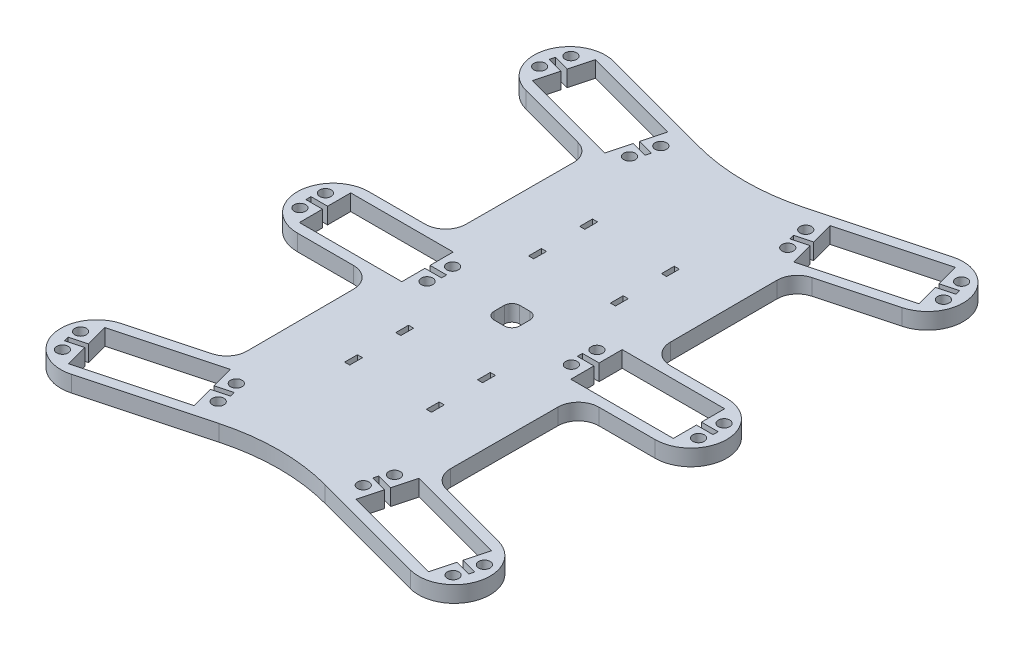
from build123d import *

# Parameters (mm, degrees)
SKETCH1_R           = 2.25
SKETCH1_W           = 40.1
SKETCH1_H           = 20.1
BOSS_EXTRUDE1_DEPTH = 6.35
FILLET1_R           = 80
FILLET2_R           = 8
SKETCH5_W           = 6.5
SKETCH5_H           = 2
CUT_EXTRUDE2_DEPTH  = 136.852736293
SKETCH6_W           = 2
SKETCH6_H           = 5
SKETCH6_W_2         = 10
SKETCH6_H_2         = 10
CUT_EXTRUDE3_DEPTH  = 10
FILLET3_R           = 3


with BuildPart() as part:
    # Sketch1 → Boss-Extrude1 (new body)
    with BuildSketch(Plane(origin=(0, 0, 0), x_dir=(1, 0, 0), z_dir=(0, 1, 0))):
        with BuildLine():
            Line((-70, 14), (-40, 14))
            Line((-40, 14), (-39.816062711, 70))
            Line((-39.816062711, 70), (-73.623466631, 79.058666579))
            ThreePointArc((-73.623466631, 79.058666579), (-83.522961568, 96.205094778), (-66.376533369, 106.104589715))
            Line((-66.376533369, 106.104589715), (0, 88.319051202))
            Line((0, 88.319051202), (66.376533369, 106.104589715))
            ThreePointArc((66.376533369, 106.104589715), (83.522961568, 96.205094778), (73.623466631, 79.058666579))
            Line((73.623466631, 79.058666579), (39.816062711, 70))
            Line((39.816062711, 70), (40, 14))
            Line((40, 14), (70, 14))
            ThreePointArc((70, 14), (84, 0), (70, -14))
            Line((70, -14), (40, -14))
            Line((40, -14), (39.816062711, -70))
            Line((39.816062711, -70), (73.623466631, -79.058666579))
            ThreePointArc((73.623466631, -79.058666579), (83.522961568, -96.205094778), (66.376533369, -106.104589715))
            Line((66.376533369, -106.104589715), (0, -88.319051202))
            Line((0, -88.319051202), (-66.376533369, -106.104589715))
            ThreePointArc((-66.376533369, -106.104589715), (-83.522961568, -96.205094778), (-73.623466631, -79.058666579))
            Line((-73.623466631, -79.058666579), (-39.816062711, -70))
            Line((-39.816062711, -70), (-40, -14))
            Line((-40, -14), (-70, -14))
            ThreePointArc((-70, -14), (-84, 0), (-70, 14))
        make_face()
        with Locations(Location((-76.433311385, 99.481809639, 0), (0, 0, 270))):
            Circle(SKETCH1_R, mode=Mode.SUBTRACT)
        with Locations(Location((-79.021501836, 89.822551376, 0), (0, 0, 270))):
            Circle(SKETCH1_R, mode=Mode.SUBTRACT)
        with Locations(Location((-78, 5, 0), (0, 0, 270))):
            Circle(SKETCH1_R, mode=Mode.SUBTRACT)
        with Locations(Location((-79.021501836, -89.822551376, 0), (0, 0, 90))):
            Circle(SKETCH1_R, mode=Mode.SUBTRACT)
        with Locations(Location((-76.433311385, -99.481809639, 0), (0, 0, 90))):
            Circle(SKETCH1_R, mode=Mode.SUBTRACT)
        with Locations(Location((-78, -5, 0), (0, 0, 270))):
            Circle(SKETCH1_R, mode=Mode.SUBTRACT)
        with Locations(Location((78, -5, 0), (0, 0, 90))):
            Circle(SKETCH1_R, mode=Mode.SUBTRACT)
        with Locations(Location((76.433311385, -99.481809639, 0), (0, 0, 270))):
            Circle(SKETCH1_R, mode=Mode.SUBTRACT)
        with Locations(Location((79.021501836, -89.822551376, 0), (0, 0, 270))):
            Circle(SKETCH1_R, mode=Mode.SUBTRACT)
        with Locations(Location((78, 5, 0), (0, 0, 90))):
            Circle(SKETCH1_R, mode=Mode.SUBTRACT)
        with Locations(Location((79.021501836, 89.822551376, 0), (0, 0, 90))):
            Circle(SKETCH1_R, mode=Mode.SUBTRACT)
        with Locations(Location((76.433311385, 99.481809639, 0), (0, 0, 90))):
            Circle(SKETCH1_R, mode=Mode.SUBTRACT)
        with Locations(Location((-30.95703272, 76.943715692, 0), (0, 0, 90))):
            Circle(SKETCH1_R, mode=Mode.SUBTRACT)
        with Locations(Location((-28.368842269, 86.602973955, 0), (0, 0, 90))):
            Circle(SKETCH1_R, mode=Mode.SUBTRACT)
        with Locations(Location((-28.24, -5, 0), (0, 0, 90))):
            Circle(SKETCH1_R, mode=Mode.SUBTRACT)
        with Locations(Location((-28.24, 5, 0), (0, 0, 90))):
            Circle(SKETCH1_R, mode=Mode.SUBTRACT)
        with Locations(Location((-28.368842269, -86.602973955, 0), (0, 0, 270))):
            Circle(SKETCH1_R, mode=Mode.SUBTRACT)
        with Locations(Location((-30.95703272, -76.943715692, 0), (0, 0, 270))):
            Circle(SKETCH1_R, mode=Mode.SUBTRACT)
        with Locations(Location((28.368842269, 86.602973955, 0), (0, 0, 270))):
            Circle(SKETCH1_R, mode=Mode.SUBTRACT)
        with Locations(Location((30.95703272, 76.943715692, 0), (0, 0, 270))):
            Circle(SKETCH1_R, mode=Mode.SUBTRACT)
        with Locations(Location((28.24, 5, 0), (0, 0, 270))):
            Circle(SKETCH1_R, mode=Mode.SUBTRACT)
        with Locations(Location((28.24, -5, 0), (0, 0, 270))):
            Circle(SKETCH1_R, mode=Mode.SUBTRACT)
        with Locations(Location((30.95703272, -76.943715692, 0), (0, 0, 90))):
            Circle(SKETCH1_R, mode=Mode.SUBTRACT)
        with Locations(Location((28.368842269, -86.602973955, 0), (0, 0, 90))):
            Circle(SKETCH1_R, mode=Mode.SUBTRACT)
        Polygon((-70.460853466, 103.109639074), (-75.663116273, 83.694529965), (-36.929490638, 73.315886257), (-31.727227832, 92.730995365), align=None, mode=Mode.SUBTRACT)
        with Locations((-53.12, 0)):
            Rectangle(SKETCH1_W, SKETCH1_H, mode=Mode.SUBTRACT)
        Polygon((-36.929490638, -73.315886257), (-31.727227832, -92.730995365), (-70.460853466, -103.109639074), (-75.663116273, -83.694529965), align=None, mode=Mode.SUBTRACT)
        Polygon((36.929490638, 73.315886257), (31.727227832, 92.730995365), (70.460853466, 103.109639074), (75.663116273, 83.694529965), align=None, mode=Mode.SUBTRACT)
        with Locations((53.12, 0)):
            Rectangle(SKETCH1_W, SKETCH1_H, mode=Mode.SUBTRACT)
        Polygon((36.929490638, -73.315886257), (31.727227832, -92.730995365), (70.460853466, -103.109639074), (75.663116273, -83.694529965), align=None, mode=Mode.SUBTRACT)
    extrude(amount=BOSS_EXTRUDE1_DEPTH)

    # Fillet1
    fillet1_edges = [part.edges().sort_by_distance(p)[0] for p in [
        (0, 3.175, -88.319051202),
        (0, 3.175, 88.319051202),
    ]]
    fillet(fillet1_edges, radius=FILLET1_R)

    # Fillet2
    fillet2_edges = [part.edges().sort_by_distance(p)[0] for p in [
        (-40, 3.175, -14),
        (-39.816062711, 3.175, -70),
        (39.816062711, 3.175, -70),
        (40, 3.175, -14),
        (40, 3.175, 14),
        (39.816062711, 3.175, 70),
        (-39.816062711, 3.175, 70),
        (-40, 3.175, 14),
    ]]
    fillet(fillet2_edges, radius=FILLET2_R)

    # Sketch5 → Cut-Extrude2 (cut, through all)
    with BuildSketch(Plane(origin=(0, 6.35, 0), x_dir=(1, 0, 0), z_dir=(0, 1, 0))):
        with Locations((-29.82, 0)):
            Rectangle(SKETCH5_W, SKETCH5_H)
        with Locations((-76.42, 0)):
            Rectangle(SKETCH5_W, SKETCH5_H)
        Polygon((-34.06954019, 83.989366637), (-27.791022319, 82.307042844), (-28.308660409, 80.375191192), (-34.58717828, 82.057514985), align=None)
        Polygon((-72.803165824, 94.368010346), (-73.320803914, 92.436158693), (-79.599321785, 94.118482486), (-79.081683695, 96.050334139), align=None)
        Polygon((72.803165824, 94.368010346), (79.081683695, 96.050334139), (79.599321785, 94.118482486), (73.320803914, 92.436158693), align=None)
        Polygon((34.06954019, 83.989366637), (34.58717828, 82.057514985), (28.308660409, 80.375191192), (27.791022319, 82.307042844), align=None)
        with Locations((76.42, 0)):
            Rectangle(SKETCH5_W, SKETCH5_H)
        with Locations((29.82, 0)):
            Rectangle(SKETCH5_W, SKETCH5_H)
        Polygon((34.06954019, -83.989366637), (27.791022319, -82.307042844), (28.308660409, -80.375191192), (34.58717828, -82.057514985), align=None)
        Polygon((72.803165824, -94.368010346), (73.320803914, -92.436158693), (79.599321785, -94.118482486), (79.081683695, -96.050334139), align=None)
        Polygon((-72.803165824, -94.368010346), (-79.081683695, -96.050334139), (-79.599321785, -94.118482486), (-73.320803914, -92.436158693), align=None)
        Polygon((-34.06954019, -83.989366637), (-34.58717828, -82.057514985), (-28.308660409, -80.375191192), (-27.791022319, -82.307042844), align=None)
    extrude(amount=-CUT_EXTRUDE2_DEPTH, mode=Mode.SUBTRACT)

    # Sketch6 → Cut-Extrude3 (cut)
    with BuildSketch(Plane(origin=(0, 6.35, 0), x_dir=(1, 0, 0), z_dir=(0, 1, 0))):
        with Locations((-16, -26)):
            Rectangle(SKETCH6_W, SKETCH6_H)
        with Locations((-16, -46)):
            Rectangle(SKETCH6_W, SKETCH6_H)
        with Locations((16, -46)):
            Rectangle(SKETCH6_W, SKETCH6_H)
        with Locations((16, -26)):
            Rectangle(SKETCH6_W, SKETCH6_H)
        with Locations((16, 26)):
            Rectangle(SKETCH6_W, SKETCH6_H)
        with Locations((16, 46)):
            Rectangle(SKETCH6_W, SKETCH6_H)
        with Locations((-16, 46)):
            Rectangle(SKETCH6_W, SKETCH6_H)
        with Locations((-16, 26)):
            Rectangle(SKETCH6_W, SKETCH6_H)
        Rectangle(SKETCH6_W_2, SKETCH6_H_2)
    extrude(amount=-CUT_EXTRUDE3_DEPTH, mode=Mode.SUBTRACT)

    # Fillet3
    fillet3_edges = [part.edges().sort_by_distance(p)[0] for p in [
        (5, 3.175, -5),
        (5, 3.175, 5),
        (-5, 3.175, 5),
        (-5, 3.175, -5),
    ]]
    fillet(fillet3_edges, radius=FILLET3_R)


solid = part.part
